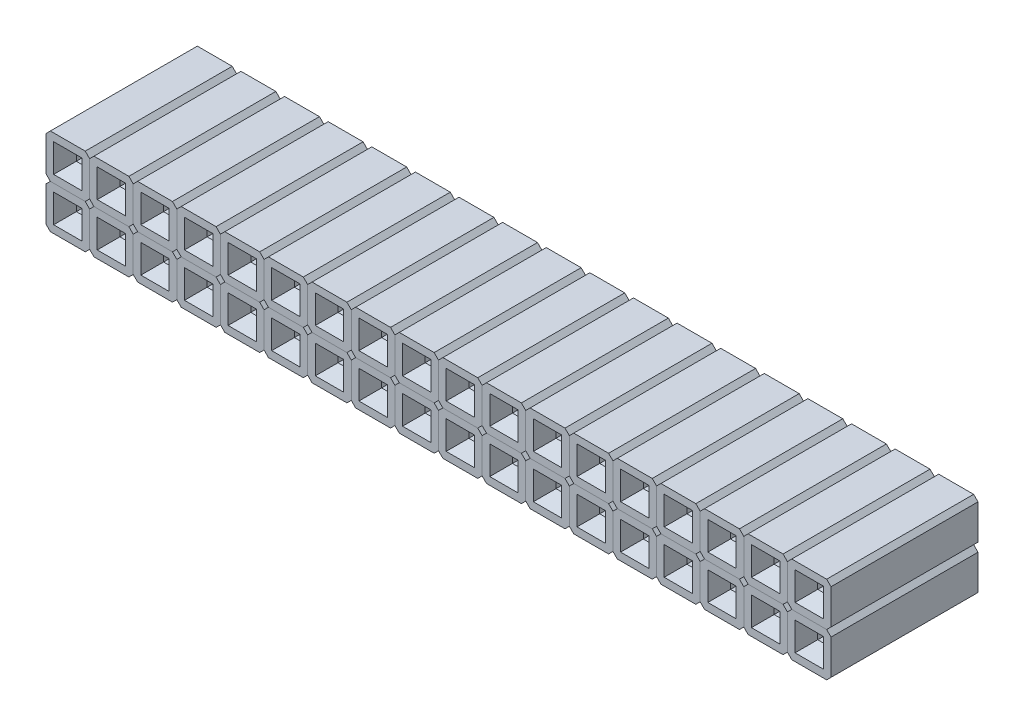
from build123d import *

# Parameters (mm, degrees)
SKETCH1_W           = 2.54
SKETCH1_H           = 2.54
BOSS_EXTRUDE1_DEPTH = 8.5598
SKETCH2_W           = 0.635
SKETCH2_H           = 0.635
CUT_EXTRUDE1_DEPTH  = 6.35
CHAMFER1_SIZE       = 0.508
CHAMFER1_SIZE2      = 0.812969941
CHAMFER2_SIZE       = 0.254
LPATTERN1_COUNT     = 18
LPATTERN1_PITCH     = 2.54
LPATTERN1_2_COUNT   = 2
LPATTERN1_2_PITCH   = 2.54


with BuildPart() as part:
    # Sketch1 → Boss-Extrude1 (new body)
    with BuildSketch(Plane.XY):
        with Locations((1.27, 1.27)):
            Rectangle(SKETCH1_W, SKETCH1_H)
    extrude(amount=BOSS_EXTRUDE1_DEPTH)

    # Sketch2 → Cut-Extrude1 (cut)
    with BuildSketch(Plane.XY.offset(8.5598)):
        with Locations((1.27, 1.27)):
            Rectangle(SKETCH2_W, SKETCH2_H)
    extrude(amount=-CUT_EXTRUDE1_DEPTH, mode=Mode.SUBTRACT)

    # Chamfer1
    chamfer1_edges = [part.edges().sort_by_distance(p)[0] for p in [
        (1.5875, 1.27, 8.5598),
        (1.27, 1.5875, 8.5598),
        (0.9525, 1.27, 8.5598),
        (1.27, 0.9525, 8.5598),
    ]]
    chamfer1_side = [part.faces().sort_by_distance(p)[0] for p in [
        (1.27, 0.035921024, 8.5598),
    ]]
    chamfer(chamfer1_edges, length=CHAMFER1_SIZE, length2=CHAMFER1_SIZE2, reference=chamfer1_side[0])

    # Chamfer2
    chamfer2_edges = [part.edges().sort_by_distance(p)[0] for p in [
        (0, 2.54, 4.2799),
        (2.54, 2.54, 4.2799),
        (2.54, 0, 4.2799),
        (0, 0, 4.2799),
    ]]
    chamfer(chamfer2_edges, length=CHAMFER2_SIZE)


with BuildPart() as lpattern1_1:
    # LPattern1: pattern copy
    add(part.part.moved(Location(Vector(-1, 0, 0) * (1 * LPATTERN1_PITCH))))


with BuildPart() as lpattern1_2:
    # LPattern1: pattern copy
    add(part.part.moved(Location(Vector(-1, 0, 0) * (2 * LPATTERN1_PITCH))))


with BuildPart() as lpattern1_3:
    # LPattern1: pattern copy
    add(part.part.moved(Location(Vector(-1, 0, 0) * (3 * LPATTERN1_PITCH))))


with BuildPart() as lpattern1_4:
    # LPattern1: pattern copy
    add(part.part.moved(Location(Vector(-1, 0, 0) * (4 * LPATTERN1_PITCH))))


with BuildPart() as lpattern1_5:
    # LPattern1: pattern copy
    add(part.part.moved(Location(Vector(-1, 0, 0) * (5 * LPATTERN1_PITCH))))


with BuildPart() as lpattern1_6:
    # LPattern1: pattern copy
    add(part.part.moved(Location(Vector(-1, 0, 0) * (6 * LPATTERN1_PITCH))))


with BuildPart() as lpattern1_7:
    # LPattern1: pattern copy
    add(part.part.moved(Location(Vector(-1, 0, 0) * (7 * LPATTERN1_PITCH))))


with BuildPart() as lpattern1_8:
    # LPattern1: pattern copy
    add(part.part.moved(Location(Vector(-1, 0, 0) * (8 * LPATTERN1_PITCH))))


with BuildPart() as lpattern1_9:
    # LPattern1: pattern copy
    add(part.part.moved(Location(Vector(-1, 0, 0) * (9 * LPATTERN1_PITCH))))


with BuildPart() as lpattern1_10:
    # LPattern1: pattern copy
    add(part.part.moved(Location(Vector(-1, 0, 0) * (10 * LPATTERN1_PITCH))))


with BuildPart() as lpattern1_11:
    # LPattern1: pattern copy
    add(part.part.moved(Location(Vector(-1, 0, 0) * (11 * LPATTERN1_PITCH))))


with BuildPart() as lpattern1_12:
    # LPattern1: pattern copy
    add(part.part.moved(Location(Vector(-1, 0, 0) * (12 * LPATTERN1_PITCH))))


with BuildPart() as lpattern1_13:
    # LPattern1: pattern copy
    add(part.part.moved(Location(Vector(-1, 0, 0) * (13 * LPATTERN1_PITCH))))


with BuildPart() as lpattern1_14:
    # LPattern1: pattern copy
    add(part.part.moved(Location(Vector(-1, 0, 0) * (14 * LPATTERN1_PITCH))))


with BuildPart() as lpattern1_15:
    # LPattern1: pattern copy
    add(part.part.moved(Location(Vector(-1, 0, 0) * (15 * LPATTERN1_PITCH))))


with BuildPart() as lpattern1_16:
    # LPattern1: pattern copy
    add(part.part.moved(Location(Vector(-1, 0, 0) * (16 * LPATTERN1_PITCH))))


with BuildPart() as lpattern1_17:
    # LPattern1: pattern copy
    add(part.part.moved(Location(Vector(-1, 0, 0) * (17 * LPATTERN1_PITCH))))


with BuildPart() as lpattern1_2_1:
    # LPattern1 2: pattern copy
    add(part.part.moved(Location(Vector(0, 1, 0) * (1 * LPATTERN1_2_PITCH))))


with BuildPart() as lpattern1_2_2:
    # LPattern1 2: pattern copy
    add(lpattern1_1.part.moved(Location(Vector(0, 1, 0) * (1 * LPATTERN1_2_PITCH))))


with BuildPart() as lpattern1_2_3:
    # LPattern1 2: pattern copy
    add(lpattern1_2.part.moved(Location(Vector(0, 1, 0) * (1 * LPATTERN1_2_PITCH))))


with BuildPart() as lpattern1_2_4:
    # LPattern1 2: pattern copy
    add(lpattern1_3.part.moved(Location(Vector(0, 1, 0) * (1 * LPATTERN1_2_PITCH))))


with BuildPart() as lpattern1_2_5:
    # LPattern1 2: pattern copy
    add(lpattern1_4.part.moved(Location(Vector(0, 1, 0) * (1 * LPATTERN1_2_PITCH))))


with BuildPart() as lpattern1_2_6:
    # LPattern1 2: pattern copy
    add(lpattern1_5.part.moved(Location(Vector(0, 1, 0) * (1 * LPATTERN1_2_PITCH))))


with BuildPart() as lpattern1_2_7:
    # LPattern1 2: pattern copy
    add(lpattern1_6.part.moved(Location(Vector(0, 1, 0) * (1 * LPATTERN1_2_PITCH))))


with BuildPart() as lpattern1_2_8:
    # LPattern1 2: pattern copy
    add(lpattern1_7.part.moved(Location(Vector(0, 1, 0) * (1 * LPATTERN1_2_PITCH))))


with BuildPart() as lpattern1_2_9:
    # LPattern1 2: pattern copy
    add(lpattern1_8.part.moved(Location(Vector(0, 1, 0) * (1 * LPATTERN1_2_PITCH))))


with BuildPart() as lpattern1_2_10:
    # LPattern1 2: pattern copy
    add(lpattern1_9.part.moved(Location(Vector(0, 1, 0) * (1 * LPATTERN1_2_PITCH))))


with BuildPart() as lpattern1_2_11:
    # LPattern1 2: pattern copy
    add(lpattern1_10.part.moved(Location(Vector(0, 1, 0) * (1 * LPATTERN1_2_PITCH))))


with BuildPart() as lpattern1_2_12:
    # LPattern1 2: pattern copy
    add(lpattern1_11.part.moved(Location(Vector(0, 1, 0) * (1 * LPATTERN1_2_PITCH))))


with BuildPart() as lpattern1_2_13:
    # LPattern1 2: pattern copy
    add(lpattern1_12.part.moved(Location(Vector(0, 1, 0) * (1 * LPATTERN1_2_PITCH))))


with BuildPart() as lpattern1_2_14:
    # LPattern1 2: pattern copy
    add(lpattern1_13.part.moved(Location(Vector(0, 1, 0) * (1 * LPATTERN1_2_PITCH))))


with BuildPart() as lpattern1_2_15:
    # LPattern1 2: pattern copy
    add(lpattern1_14.part.moved(Location(Vector(0, 1, 0) * (1 * LPATTERN1_2_PITCH))))


with BuildPart() as lpattern1_2_16:
    # LPattern1 2: pattern copy
    add(lpattern1_15.part.moved(Location(Vector(0, 1, 0) * (1 * LPATTERN1_2_PITCH))))


with BuildPart() as lpattern1_2_17:
    # LPattern1 2: pattern copy
    add(lpattern1_16.part.moved(Location(Vector(0, 1, 0) * (1 * LPATTERN1_2_PITCH))))


with BuildPart() as lpattern1_2_18:
    # LPattern1 2: pattern copy
    add(lpattern1_17.part.moved(Location(Vector(0, 1, 0) * (1 * LPATTERN1_2_PITCH))))


solid = Compound([part.part, lpattern1_1.part, lpattern1_2.part, lpattern1_3.part, lpattern1_4.part, lpattern1_5.part, lpattern1_6.part, lpattern1_7.part, lpattern1_8.part, lpattern1_9.part, lpattern1_10.part, lpattern1_11.part, lpattern1_12.part, lpattern1_13.part, lpattern1_14.part, lpattern1_15.part, lpattern1_16.part, lpattern1_17.part, lpattern1_2_1.part, lpattern1_2_2.part, lpattern1_2_3.part, lpattern1_2_4.part, lpattern1_2_5.part, lpattern1_2_6.part, lpattern1_2_7.part, lpattern1_2_8.part, lpattern1_2_9.part, lpattern1_2_10.part, lpattern1_2_11.part, lpattern1_2_12.part, lpattern1_2_13.part, lpattern1_2_14.part, lpattern1_2_15.part, lpattern1_2_16.part, lpattern1_2_17.part, lpattern1_2_18.part])
